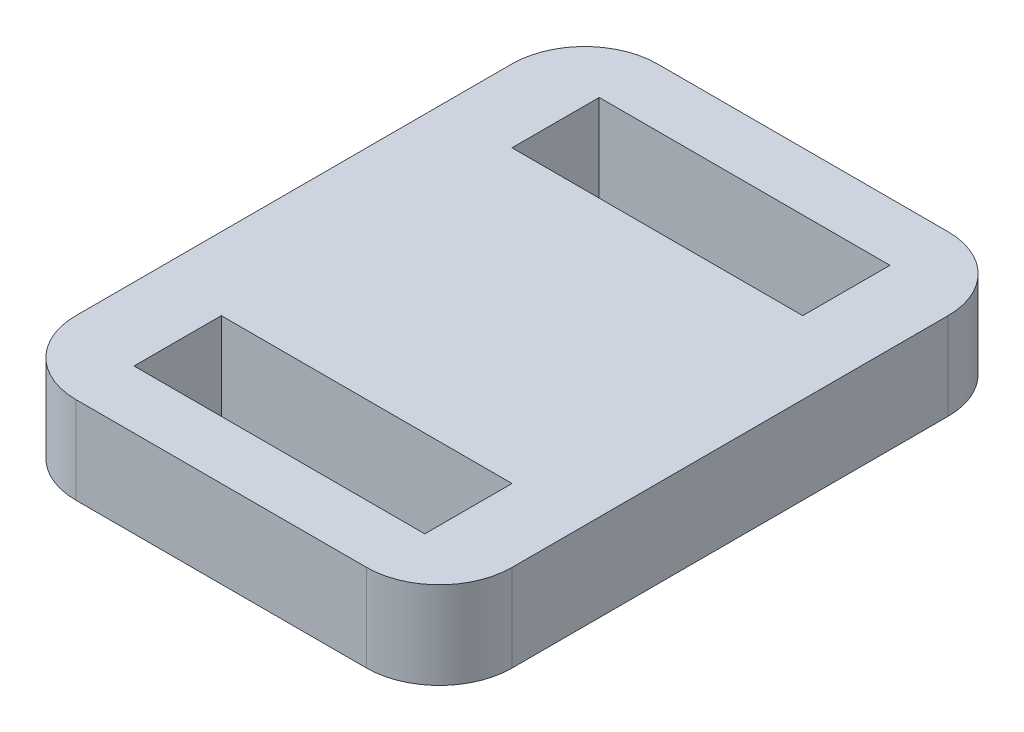
from build123d import *

# Parameters (mm, degrees)
SKETCH1_W           = 20
SKETCH1_H           = 6
BOSS_EXTRUDE1_DEPTH = 6


with BuildPart() as part:
    # Sketch1 → Boss-Extrude1 (new body)
    with BuildSketch(Plane(origin=(0, 0, 0), x_dir=(1, 0, 0), z_dir=(0, 1, 0))):
        with BuildLine():
            Line((-10, 33), (10, 33))
            ThreePointArc((10, 33), (13.535533906, 31.535533906), (15, 28))
            Line((15, 28), (15, -2))
            ThreePointArc((15, -2), (13.535533906, -5.535533906), (10, -7))
            Line((10, -7), (-10, -7))
            ThreePointArc((-10, -7), (-13.535533906, -5.535533906), (-15, -2))
            Line((-15, -2), (-15, 28))
            ThreePointArc((-15, 28), (-13.535533906, 31.535533906), (-10, 33))
        make_face()
        with Locations((0, 26)):
            Rectangle(SKETCH1_W, SKETCH1_H, mode=Mode.SUBTRACT)
        Rectangle(SKETCH1_W, SKETCH1_H, mode=Mode.SUBTRACT)
    extrude(amount=BOSS_EXTRUDE1_DEPTH)


solid = part.part
